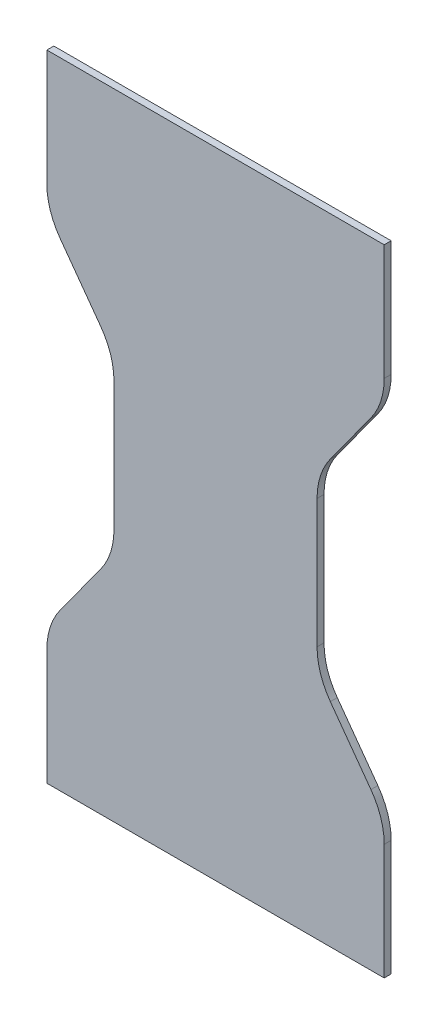
from build123d import *

# Parameters (mm, degrees)
SALIENTE_EXTRUIR1_DEPTH = 3
REDONDEO1_R             = 30


with BuildPart() as part:
    # Croquis1 → Saliente-Extruir1 (new body)
    with BuildSketch(Plane.XY):
        Polygon((72.862780289, -137.153468779), (-72.862780289, -137.153468779), (-72.862780289, -77.415075694), (-43.862780289, -37.5), (-43.862780289, 37.5), (-72.862780289, 77.415075694), (-72.862780289, 137.153468779), (72.862780289, 137.153468779), (72.862780289, 77.415075694), (43.862780289, 37.5), (43.862780289, -37.5), (72.862780289, -77.415075694), align=None)
    extrude(amount=SALIENTE_EXTRUIR1_DEPTH)

    # Redondeo1
    redondeo1_edges = [part.edges().sort_by_distance(p)[0] for p in [
        (72.862780289, 77.415075694, 1.5),
        (43.862780289, 37.5, 1.5),
        (43.862780289, -37.5, 1.5),
        (72.862780289, -77.415075694, 1.5),
        (-72.862780289, -77.415075694, 1.5),
        (-43.862780289, -37.5, 1.5),
        (-43.862780289, 37.5, 1.5),
        (-72.862780289, 77.415075694, 1.5),
    ]]
    fillet(redondeo1_edges, radius=REDONDEO1_R)


solid = part.part
